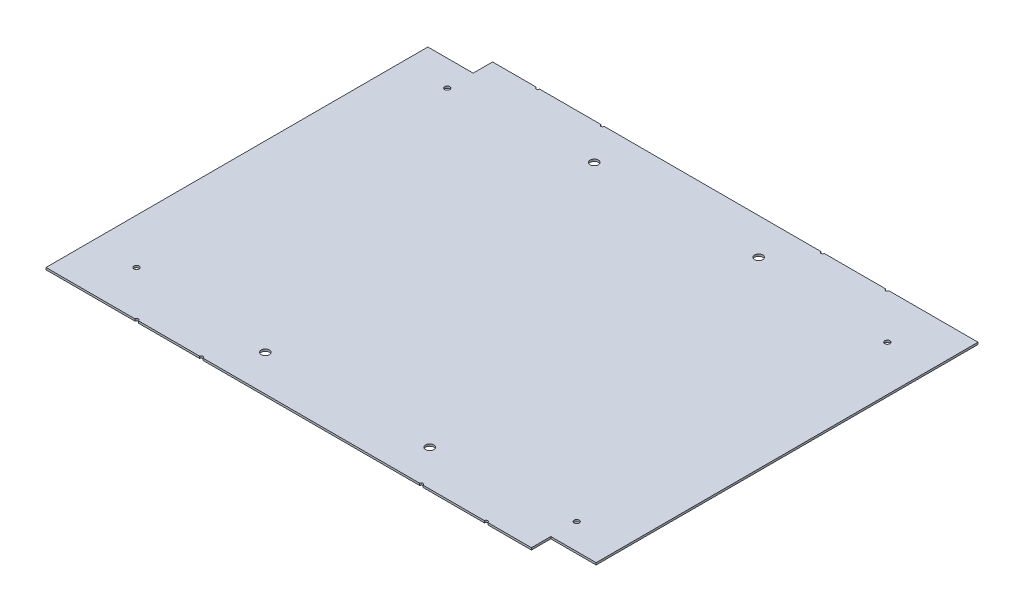
from build123d import *

# Parameters (mm, degrees)
SKETCH1_W           = 410
SKETCH1_H           = 310
BOSS_EXTRUDE1_DEPTH = 1.5875
SKETCH2_R           = 3.175
SKETCH2_R_2         = 2
CUT_EXTRUDE1_DEPTH  = 258.006848462
SKETCH3_W           = 35
SKETCH3_H           = 15
CUT_EXTRUDE2_DEPTH  = 258.006848462


with BuildPart() as part:
    # Sketch1 → Boss-Extrude1 (new body)
    with BuildSketch(Plane(origin=(0, 0, 0), x_dir=(1, 0, 0), z_dir=(0, 1, 0))):
        Rectangle(SKETCH1_W, SKETCH1_H)
    extrude(amount=BOSS_EXTRUDE1_DEPTH)

    # Sketch2 → Cut-Extrude1 (cut, through all)
    with BuildSketch(Plane(origin=(0, 1.5875, 0), x_dir=(1, 0, 0), z_dir=(0, 1, 0))):
        with Locations((-63.5, 127.06)):
            Circle(SKETCH2_R)
        with Locations((-170, 120)):
            Circle(SKETCH2_R_2)
        with Locations((63.5, 127.06)):
            Circle(SKETCH2_R)
        with Locations((170, 120)):
            Circle(SKETCH2_R_2)
        with Locations((170, -120)):
            Circle(SKETCH2_R_2)
        with Locations((63.5, -127.06)):
            Circle(SKETCH2_R)
        with Locations((-63.5, -127.06)):
            Circle(SKETCH2_R)
        with Locations((-170, -120)):
            Circle(SKETCH2_R_2)
        with BuildLine():
            Line((-136.27, 155), (-133.73, 155))
            ThreePointArc((-133.73, 155), (-135, 153.73), (-136.27, 155))
        make_face()
        with BuildLine():
            Line((-86.27, 155), (-83.73, 155))
            ThreePointArc((-83.73, 155), (-85, 153.73), (-86.27, 155))
        make_face()
        with BuildLine():
            Line((86.27, 155), (83.73, 155))
            ThreePointArc((83.73, 155), (85, 153.73), (86.27, 155))
        make_face()
        with BuildLine():
            Line((136.27, 155), (133.73, 155))
            ThreePointArc((133.73, 155), (135, 153.73), (136.27, 155))
        make_face()
        with BuildLine():
            Line((136.27, -155), (133.73, -155))
            ThreePointArc((133.73, -155), (135, -153.73), (136.27, -155))
        make_face()
        with BuildLine():
            Line((86.27, -155), (83.73, -155))
            ThreePointArc((83.73, -155), (85, -153.73), (86.27, -155))
        make_face()
        with BuildLine():
            Line((-86.27, -155), (-83.73, -155))
            ThreePointArc((-83.73, -155), (-85, -153.73), (-86.27, -155))
        make_face()
        with BuildLine():
            Line((-136.27, -155), (-133.73, -155))
            ThreePointArc((-133.73, -155), (-135, -153.73), (-136.27, -155))
        make_face()
    extrude(amount=-CUT_EXTRUDE1_DEPTH, mode=Mode.SUBTRACT)

    # Sketch3 → Cut-Extrude2 (cut, through all)
    with BuildSketch(Plane(origin=(0, 1.5875, 0), x_dir=(1, 0, 0), z_dir=(0, 1, 0))):
        with Locations((-187.5, 147.5)):
            Rectangle(SKETCH3_W, SKETCH3_H)
        with Locations((187.5, -147.5)):
            Rectangle(SKETCH3_W, SKETCH3_H)
    extrude(amount=-CUT_EXTRUDE2_DEPTH, mode=Mode.SUBTRACT)


solid = part.part
